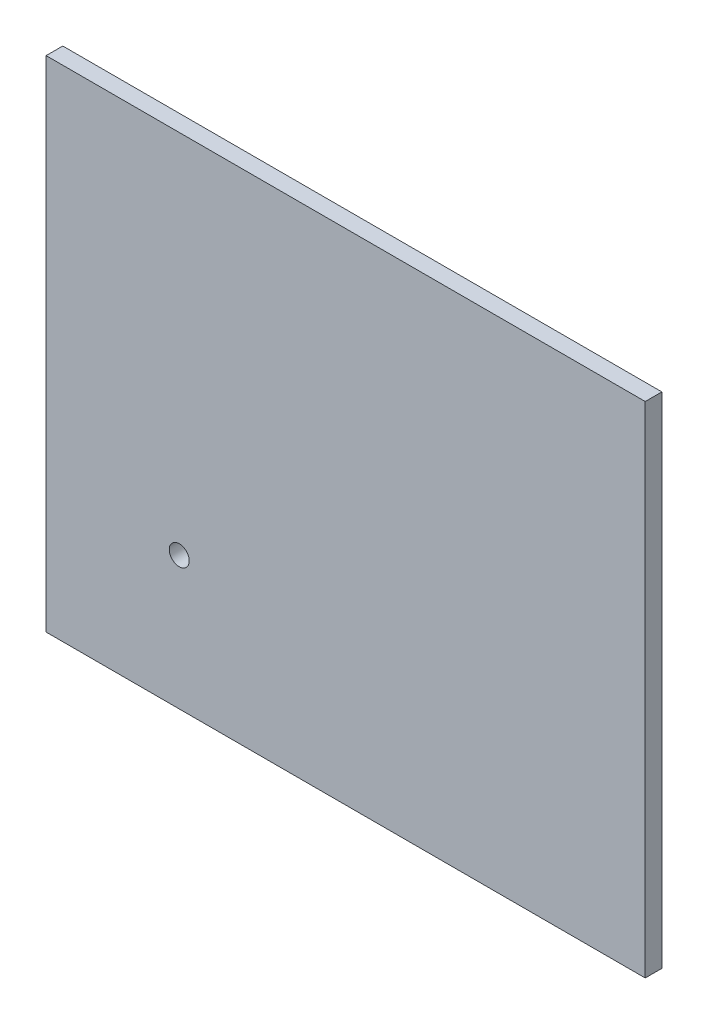
from build123d import *

# Parameters (mm, degrees)
SKETCH1_W           = 180
SKETCH1_H           = 150
SKETCH1_R           = 3
BOSS_EXTRUDE1_DEPTH = 5


with BuildPart() as part:
    # Sketch1 → Boss-Extrude1 (new body)
    with BuildSketch(Plane.XY):
        Rectangle(SKETCH1_W, SKETCH1_H)
        with Locations((-50, -35)):
            Circle(SKETCH1_R, mode=Mode.SUBTRACT)
    extrude(amount=BOSS_EXTRUDE1_DEPTH)


solid = part.part
